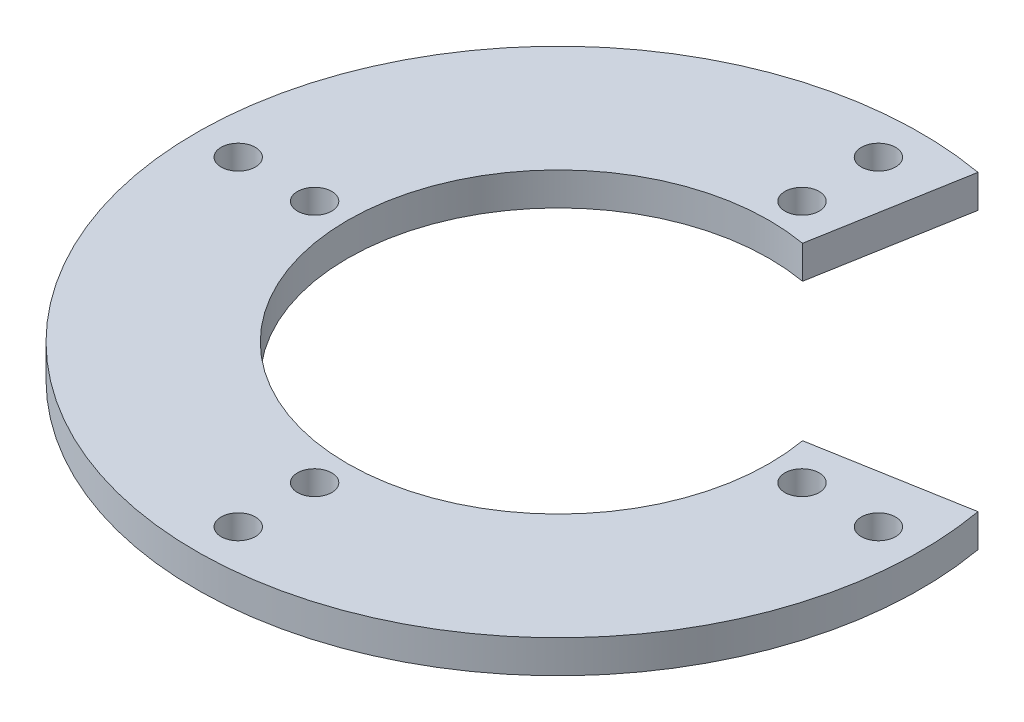
from build123d import *

# Parameters (mm, degrees)
SKETCH1_R           = 1.3
BOSS_EXTRUDE1_DEPTH = 2.5


with BuildPart() as part:
    # Sketch1 → Boss-Extrude1 (new body)
    with BuildSketch(Plane(origin=(0, 0, 0), x_dir=(1, 0, 0), z_dir=(0, 1, 0))):
        with BuildLine():
            ThreePointArc((16, 0), (-12.25671109, -10.284601755), (2.778370843, 15.756924048))
            Line((2.778370843, 15.756924048), (4.775324886, 27.082213208))
            ThreePointArc((4.775324886, 27.082213208), (-21.066222186, -17.676659266), (27.5, 0))
            ThreePointArc((27.5, 0), (27.395354198, 2.396782926), (27.082213208, 4.775324886))
            Line((27.082213208, 4.775324886), (15.756924048, 2.778370843))
            ThreePointArc((15.756924048, 2.778370843), (15.939115169, 1.394491884), (16, 0))
        make_face()
        with Locations(Location((0, -24.3, 0), (0, 0, 270))):
            Circle(SKETCH1_R, mode=Mode.SUBTRACT)
        with Locations(Location((0, -18.5, 0), (0, 0, 270))):
            Circle(SKETCH1_R, mode=Mode.SUBTRACT)
        with Locations(Location((-24.3, 0, 0), (0, 0, 270))):
            Circle(SKETCH1_R, mode=Mode.SUBTRACT)
        with Locations(Location((-18.5, 0, 0), (0, 0, 270))):
            Circle(SKETCH1_R, mode=Mode.SUBTRACT)
        with Locations(Location((0, 18.5, 0), (0, 0, 270))):
            Circle(SKETCH1_R, mode=Mode.SUBTRACT)
        with Locations(Location((18.5, 0, 0), (0, 0, 270))):
            Circle(SKETCH1_R, mode=Mode.SUBTRACT)
        with Locations(Location((24.3, 0, 0), (0, 0, 270))):
            Circle(SKETCH1_R, mode=Mode.SUBTRACT)
        with Locations(Location((0, 24.3, 0), (0, 0, 270))):
            Circle(SKETCH1_R, mode=Mode.SUBTRACT)
    extrude(amount=BOSS_EXTRUDE1_DEPTH)


solid = part.part
